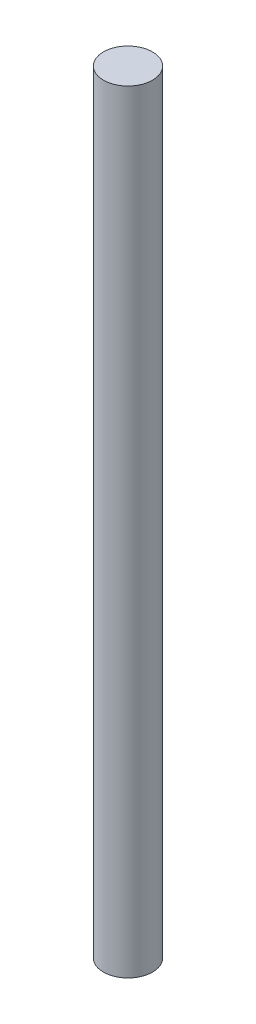
from build123d import *

# Parameters (mm, degrees)
SKETCH1_R           = 9.525
BOSS_EXTRUDE1_DEPTH = 300


with BuildPart() as part:
    # Sketch1 → Boss-Extrude1 (new body)
    with BuildSketch(Plane(origin=(0, 0, 0), x_dir=(1, 0, 0), z_dir=(0, 1, 0))):
        with Locations(Location((0, 0, 0), (0, 0, 270))):
            Circle(SKETCH1_R)
    extrude(amount=BOSS_EXTRUDE1_DEPTH)


solid = part.part
